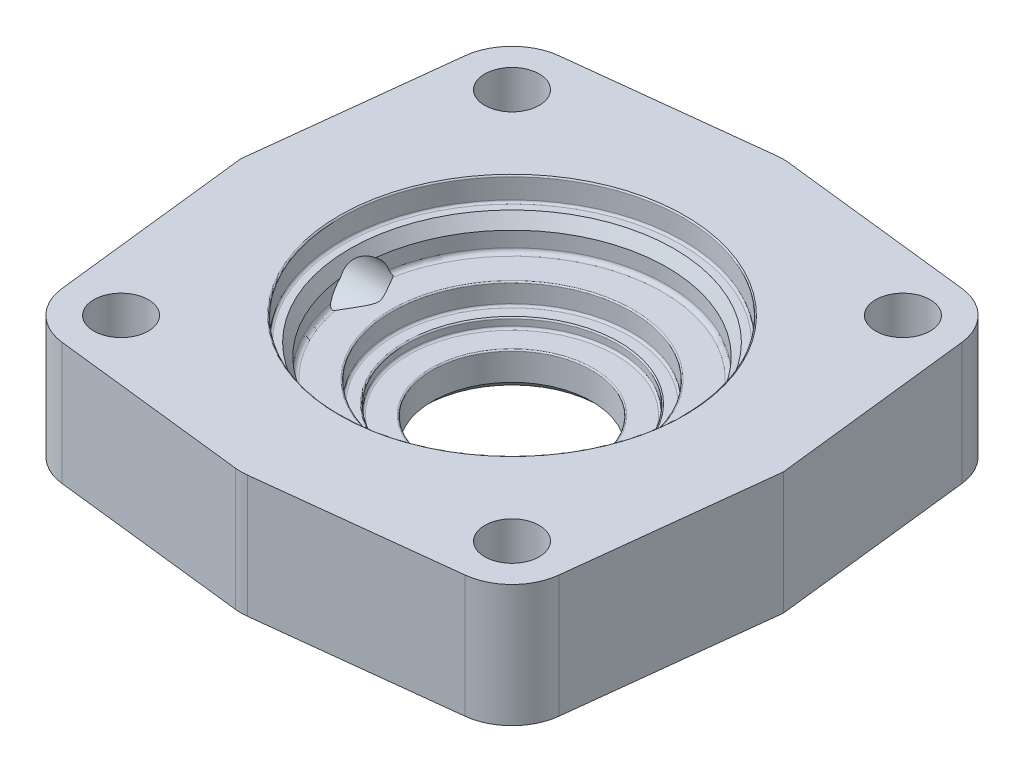
from build123d import *

# Parameters (mm, degrees)
BOSS_EXTRUDE1_DEPTH = 11.5
SKETCH5_R           = 5.125
CUT_EXTRUDE3_DEPTH  = 76.659834992
SKETCH4_R           = 44
SKETCH4_R_2         = 41.45
CUT_EXTRUDE2_DEPTH  = 1.75
FILLET1_R           = 0.25


with BuildPart() as part:
    # Sketch2 → Boss-Extrude1 (new, symmetric)
    with BuildSketch(Plane(origin=(0, 0, 0), x_dir=(1, 0, 0), z_dir=(0, 1, 0))):
        with BuildLine():
            Line((1.131558067, 50.871129935), (37.881558067, 46.685772559))
            ThreePointArc((37.881558067, 46.685772559), (43.821067812, 43.821067812), (46.685772559, 37.881558067))
            Line((46.685772559, 37.881558067), (51, 0))
            Line((51, 0), (46.685772559, -37.881558067))
            ThreePointArc((46.685772559, -37.881558067), (43.821067812, -43.821067812), (37.881558067, -46.685772559))
            Line((37.881558067, -46.685772559), (1.131558067, -50.871129935))
            ThreePointArc((1.131558067, -50.871129935), (0, -50.935357376), (-1.131558067, -50.871129935))
            Line((-1.131558067, -50.871129935), (-37.881558067, -46.685772559))
            ThreePointArc((-37.881558067, -46.685772559), (-43.821067812, -43.821067812), (-46.685772559, -37.881558067))
            Line((-46.685772559, -37.881558067), (-51, 0))
            Line((-51, 0), (-46.685772559, 37.881558067))
            ThreePointArc((-46.685772559, 37.881558067), (-43.821067812, 43.821067812), (-37.881558067, 46.685772559))
            Line((-37.881558067, 46.685772559), (-1.131558067, 50.871129935))
            ThreePointArc((-1.131558067, 50.871129935), (0, 50.935357376), (1.131558067, 50.871129935))
        make_face()
    extrude(amount=BOSS_EXTRUDE1_DEPTH, both=True)

    # Sketch5 → Cut-Extrude3 (cut, through all)
    with BuildSketch(Plane.XZ.offset(11.5)):
        with Locations(Location((-36.75, 36.75, 0), (0, 0, 270))):
            Circle(SKETCH5_R)
        with Locations(Location((36.75, 36.75, 0), (0, 0, 270))):
            Circle(SKETCH5_R)
        with Locations(Location((-36.75, -36.75, 0), (0, 0, 270))):
            Circle(SKETCH5_R)
        with Locations(Location((36.75, -36.75, 0), (0, 0, 270))):
            Circle(SKETCH5_R)
    extrude(amount=-CUT_EXTRUDE3_DEPTH, mode=Mode.SUBTRACT)

    # Sketch4 → Cut-Extrude2 (cut)
    with BuildSketch(Plane.XZ.offset(11.5)):
        with Locations(Location((0, 0, 0), (0, 0, 270))):
            Circle(SKETCH4_R)
        with Locations(Location((0, 0, 0), (0, 0, 270))):
            Circle(SKETCH4_R_2, mode=Mode.SUBTRACT)
    extrude(amount=-CUT_EXTRUDE2_DEPTH, mode=Mode.SUBTRACT)

    # Sketch6 → Cut-Revolve1 (revolve, cut)
    with BuildSketch(Plane(origin=(0, 0, 0), x_dir=(0, 0, -1), z_dir=(1, 0, 0)), mode=Mode.PRIVATE) as cut_revolve1_sk:
        with BuildLine():
            Line((32.25, 11.5), (32.25, 7.5))
            ThreePointArc((32.25, 7.5), (32.132842712, 7.217157288), (31.85, 7.1))
            Line((31.85, 7.1), (30.5, 7.1))
            Line((30.5, 7.1), (29.15, 4.76173141))
            Line((29.15, 4.76173141), (29.15, 1.9))
            ThreePointArc((29.15, 1.9), (28.915685425, 1.334314575), (28.35, 1.1))
            Line((28.35, 1.1), (22.75, 1.1))
            ThreePointArc((22.75, 1.1), (22.573223305, 1.026776695), (22.5, 0.85))
            Line((22.5, 0.85), (22.5, -2.5))
            ThreePointArc((22.5, -2.5), (22.382842712, -2.782842712), (22.1, -2.9))
            Line((22.1, -2.9), (20.15, -2.9))
            ThreePointArc((20.15, -2.9), (19.973223305, -2.973223305), (19.9, -3.15))
            Line((19.9, -3.15), (19.9, -4.3))
            ThreePointArc((19.9, -4.3), (19.782842712, -4.582842712), (19.5, -4.7))
            Line((19.5, -4.7), (15.25, -4.7))
            ThreePointArc((15.25, -4.7), (15.073223305, -4.773223305), (15, -4.95))
            Line((15, -4.95), (15, -10))
            Line((15, -10), (16.5, -11.5))
            Line((16.5, -11.5), (0, -11.5))
            Line((0, -11.5), (0, 11.5))
            Line((0, 11.5), (32.25, 11.5))
        make_face()
    revolve(cut_revolve1_sk.sketch.rotate(Axis((0, 16.721250206, 0), (0, -1, 0)), 180), axis=Axis((0, 16.721250206, 0), (0, -1, 0)), mode=Mode.SUBTRACT)

    # Fillet1
    fillet1_edges = [part.edges().sort_by_distance(p)[0] for p in [
        (0, 11.5, -32.25),
    ]]
    fillet(fillet1_edges, radius=FILLET1_R)

    # Sketch7 → Cut-Revolve2 (revolve, cut)
    with BuildSketch(Plane.XY, mode=Mode.PRIVATE) as cut_revolve2_sk:
        Polygon((-52.009628693, 10), (-49.5, 10), (-49.5, 5.8), (-27.98499159, 5.8), (-24.5, 0), (-52.009628693, 0), align=None)
    revolve(cut_revolve2_sk.sketch.rotate(Axis((-52.009628693, 0, 0), (1, 0, 0)), 90), axis=Axis((-52.009628693, 0, 0), (1, 0, 0)), mode=Mode.SUBTRACT)

    # Sketch9 → Cut-Revolve3 (revolve, cut)
    with BuildSketch(Plane.XY):
        Polygon((26.468244231, 7.953971651), (24.303180721, 6.703971651), (37.448959942, -16.065185865), (39.614023451, -14.815185865), align=None)
    revolve(axis=Axis((26.468244231, 7.953971651, 0), (0.4999999999999948, -0.8660254037844417, 0)), mode=Mode.SUBTRACT)


solid = part.part
